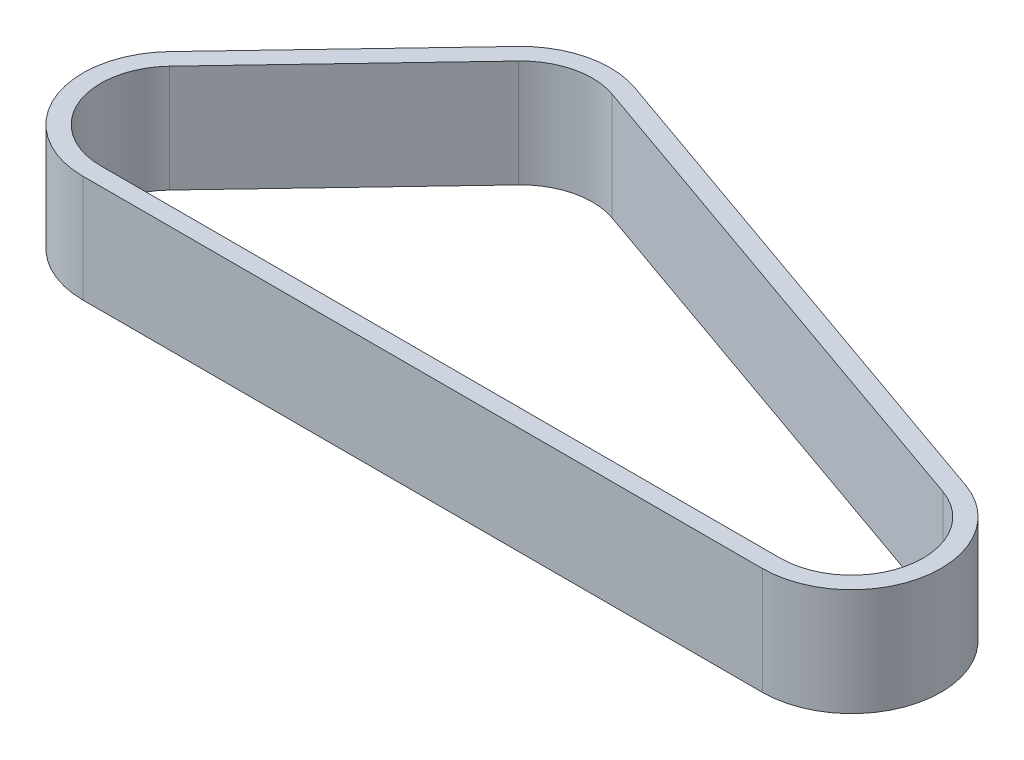
from build123d import *

# Parameters (mm, degrees)
EXTRUDE_1_DEPTH = 15
SCALE1_SCALE    = 2


with BuildPart() as part:
    # 草图1 → 凸台-拉伸1 (new, symmetric)
    with BuildSketch(Plane(origin=(0, 0, 0), x_dir=(1, 0, 0), z_dir=(0, 1, 0))):
        with BuildLine():
            Line((-39.222807174, 73.589999553), (103.277192826, 23.589999553))
            ThreePointArc((103.277192826, 23.589999553), (119.644979091, -4.198214571), (95, -25))
            Line((95, -25), (-95, -25))
            ThreePointArc((-95, -25), (-117.972466277, -9.862342174), (-113.12498584, 17.218736548))
            Line((-113.12498584, 17.218736548), (-65.62498584, 67.218736548))
            ThreePointArc((-65.62498584, 67.218736548), (-53.36455496, 74.302407188), (-39.222807174, 73.589999553))
        make_face()
        with BuildLine():
            Line((-61.999988672, 63.774989238), (-109.499988672, 13.774989238))
            ThreePointArc((-109.499988672, 13.774989238), (-113.377973022, -7.889873739), (-95, -20))
            Line((-95, -20), (95, -20))
            ThreePointArc((95, -20), (114.715983273, -3.358571657), (101.621754261, 18.871999643))
            Line((101.621754261, 18.871999643), (-40.878245739, 68.871999643))
            ThreePointArc((-40.878245739, 68.871999643), (-52.191643968, 69.44192575), (-61.999988672, 63.774989238))
        make_face(mode=Mode.SUBTRACT)
    extrude(amount=EXTRUDE_1_DEPTH, both=True)


with BuildPart() as part_1:
    # Scale1: scaled about (-2.797311239, 0, -12.318069734)
    add(part.part.scale(SCALE1_SCALE).moved(Location((2.797311239, 0, 12.318069734))))


solid = part_1.part
